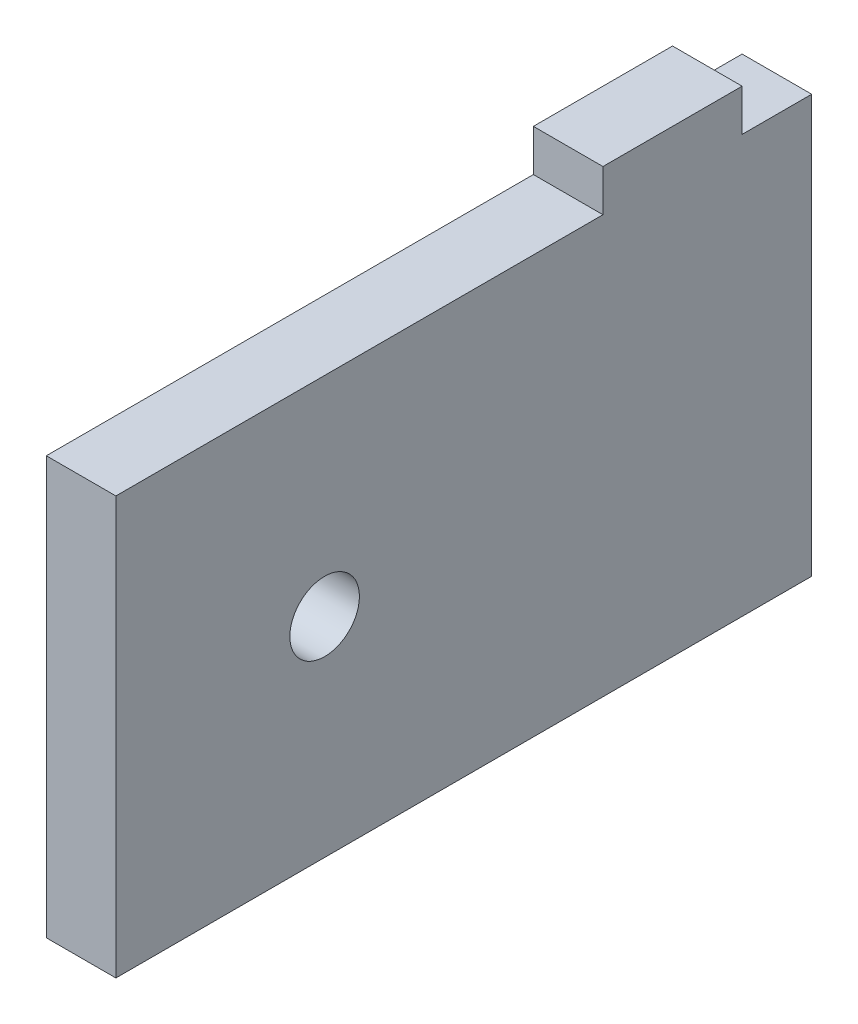
from build123d import *

# Parameters (mm, degrees)
SKETCH1_W          = 50
SKETCH1_H          = 30
EXTRUDE1_DEPTH     = 5
SKETCH2_W          = 10
SKETCH2_H          = 3
EXTRUDE2_DEPTH     = 5
SKETCH3_R          = 2.5
CUT_EXTRUDE1_DEPTH = 32.208973069


with BuildPart() as part:
    # Sketch1 → Extrude1 (new body)
    with BuildSketch(Plane(origin=(0, 0, 0), x_dir=(0, 0, -1), z_dir=(1, 0, 0))):
        Rectangle(SKETCH1_W, SKETCH1_H)
    extrude(amount=EXTRUDE1_DEPTH)

    # Sketch2 → Extrude2 (add)
    with BuildSketch(Plane(origin=(5, 0, 0), x_dir=(0, 0, -1), z_dir=(1, 0, 0))):
        with Locations((15, 16.5)):
            Rectangle(SKETCH2_W, SKETCH2_H)
    extrude(amount=-EXTRUDE2_DEPTH)

    # Sketch3 → Cut-Extrude1 (cut, through all)
    with BuildSketch(Plane(origin=(5, 0, 0), x_dir=(0, 0, -1), z_dir=(1, 0, 0))):
        with Locations((-10, 0)):
            Circle(SKETCH3_R)
    extrude(amount=-CUT_EXTRUDE1_DEPTH, mode=Mode.SUBTRACT)


solid = part.part
